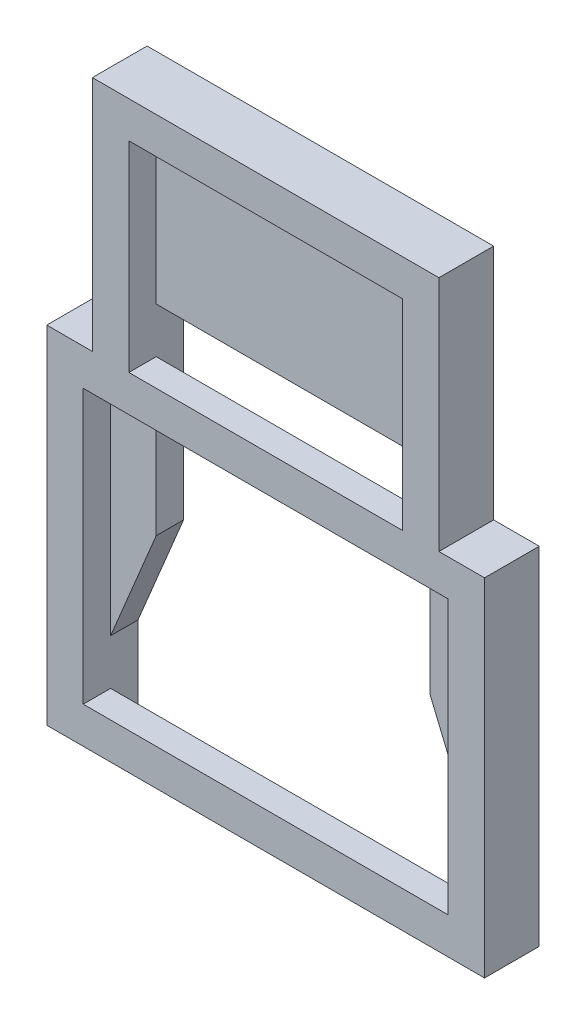
from build123d import *

# Parameters (mm, degrees)
ESBO_O1_W                = 20
ESBO_O1_H                = 15
ESBO_O1_W_2              = 15
ESBO_O1_H_2              = 11
RESSALTO_EXTRUS_O1_DEPTH = 1.5
RESSALTO_EXTRUS_O2_DEPTH = 1.5


with BuildPart() as part:
    # Esboço1 → Ressalto-extrusão1 (new body)
    with BuildSketch(Plane.XY):
        Polygon((12, -2), (12, 17), (9.5, 17), (9.5, 30), (-9.5, 30), (-9.5, 17), (-12, 17), (-12, -2), align=None)
        with Locations((0, 7.5)):
            Rectangle(ESBO_O1_W, ESBO_O1_H, mode=Mode.SUBTRACT)
        with Locations((0, 22.5)):
            Rectangle(ESBO_O1_W_2, ESBO_O1_H_2, mode=Mode.SUBTRACT)
    extrude(amount=RESSALTO_EXTRUS_O1_DEPTH)

    # Esboço1<4> → Ressalto-extrusão2 (add)
    with BuildSketch(Plane.XY):
        Polygon((10, 2.5), (10, -2), (12, -2), (12, 17), (9.5, 17), (9.5, 30), (-9.5, 30), (-9.5, 17), (-12, 17), (-12, -2), (-10, -2), (-10, 2.5), (-7.5, 8.5), (-7.5, 19.5), (7.5, 19.5), (7.5, 8.5), align=None)
    extrude(amount=-RESSALTO_EXTRUS_O2_DEPTH)


solid = part.part
